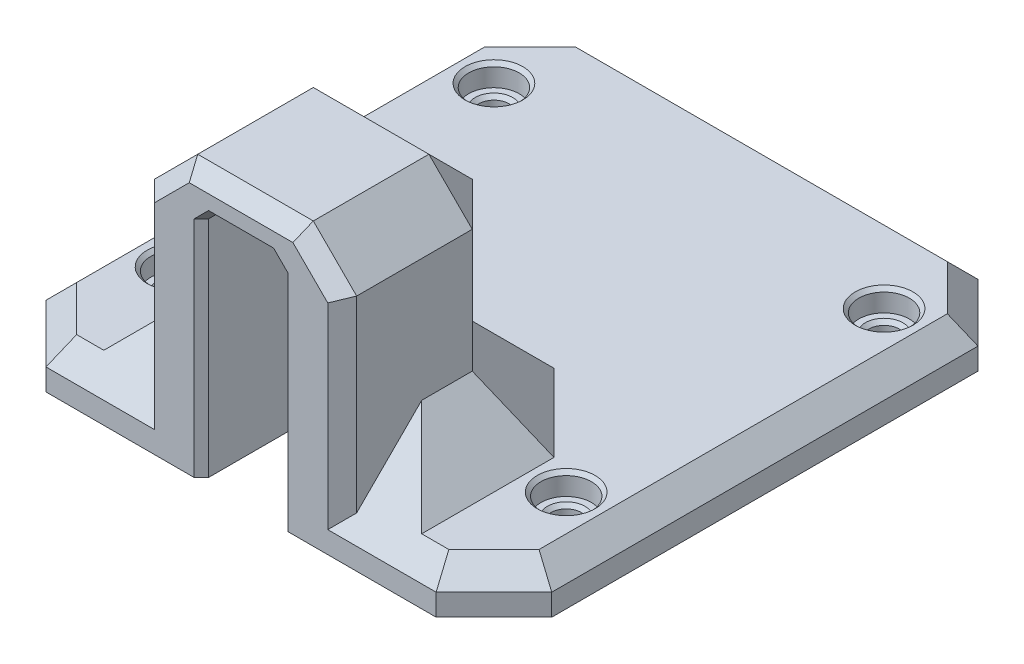
from build123d import *

# Parameters (mm, degrees)
SKETCH1_R                          = 2.1
MAIN_CAP_EXTRUDE_DEPTH             = 6
MAIN_BODY_CHAMFER_SIZE             = 3
SKETCH4_R                          = 3.5
HOLE_COUNTERSINK_CUT_DEPTH         = 3
HOLE_COUNTERSINK_CHAMFER_SIZE      = 0.5
MAIN_PINION_CHIMNEY_EXTRUDE_DEPTH  = 32
SKETCH3_W                          = 28
SKETCH3_H                          = 24
PINION_CHIMNEY_CAP_EXTRUDE_DEPTH   = 5
INTERNAL_CHIMNEY_CHAMFER_SIZE      = 1
MAIN_CHIMNEY_EXTERNAL_CHAMFER_SIZE = 6
CHIMNEY_PLATE_CHAMFER_SIZE         = 8
CHIMNEY_FRONT_CHAMFER_SIZE         = 2


with BuildPart() as part:
    # Sketch1 → Main Cap Extrude (new body)
    with BuildSketch(Plane(origin=(0, 0, 0), x_dir=(1, 0, 0), z_dir=(0, 1, 0))):
        Polygon((-35, 27), (-27, 35), (27, 35), (35, 27), (35, -32), (27, -40), (5.5, -40), (5.5, -27.857106781), (9.5, -23.857106781), (9.5, -20.65), (-9.5, -20.65), (-9.5, -23.857106781), (-5.5, -27.857106781), (-5.5, -40), (-27, -40), (-35, -32), align=None)
        with Locations(Location((-27, 22, 0), (0, 0, 270))):
            Circle(SKETCH1_R, mode=Mode.SUBTRACT)
        with Locations(Location((27, 22, 0), (0, 0, 90))):
            Circle(SKETCH1_R, mode=Mode.SUBTRACT)
        with Locations(Location((27, -22, 0), (0, 0, 270))):
            Circle(SKETCH1_R, mode=Mode.SUBTRACT)
        with Locations(Location((-27, -22, 0), (0, 0, 90))):
            Circle(SKETCH1_R, mode=Mode.SUBTRACT)
    extrude(amount=MAIN_CAP_EXTRUDE_DEPTH)

    # Main Body Chamfer
    main_body_chamfer_edges = [part.edges().sort_by_distance(p)[0] for p in [
        (-31, 6, -31),
        (-35, 6, 2.5),
        (-31, 6, 36),
        (-16.25, 6, 40),
        (31, 6, -31),
        (16.25, 6, 40),
        (31, 6, 36),
        (35, 6, 2.5),
        (0, 6, -35),
    ]]
    chamfer(main_body_chamfer_edges, length=MAIN_BODY_CHAMFER_SIZE)

    # Sketch4 → Hole Countersink Cut (cut)
    with BuildSketch(Plane(origin=(0, 6, 0), x_dir=(1, 0, 0), z_dir=(0, 1, 0))):
        with Locations(Location((-27, 22, 0), (0, 0, 270))):
            Circle(SKETCH4_R)
        with Locations(Location((-27, -22, 0), (0, 0, 270))):
            Circle(SKETCH4_R)
        with Locations(Location((27, -22, 0), (0, 0, 270))):
            Circle(SKETCH4_R)
        with Locations(Location((27, 22, 0), (0, 0, 270))):
            Circle(SKETCH4_R)
    extrude(amount=-HOLE_COUNTERSINK_CUT_DEPTH, mode=Mode.SUBTRACT)

    # Hole Countersink Chamfer
    hole_countersink_chamfer_edges = [part.edges().sort_by_distance(p)[0] for p in [
        (27, 3, -19.9),
        (27, 6, -25.5),
        (27, 3, 19.9),
        (27, 6, 18.5),
        (-27, 3, 24.1),
        (-27, 6, 18.5),
        (-27, 3, -24.1),
        (-27, 6, -25.5),
    ]]
    chamfer(hole_countersink_chamfer_edges, length=HOLE_COUNTERSINK_CHAMFER_SIZE)

    # Sketch2 → Main Pinion Chimney Extrude (add)
    with BuildSketch(Plane(origin=(0, 0, 0), x_dir=(1, 0, 0), z_dir=(0, 1, 0))):
        Polygon((5.5, -27.857106781), (5.5, -40), (14, -40), (14, -16), (-14, -16), (-14, -40), (-5.5, -40), (-5.5, -27.857106781), (-9.5, -23.857106781), (-9.5, -20.65), (9.5, -20.65), (9.5, -23.857106781), align=None)
    extrude(amount=MAIN_PINION_CHIMNEY_EXTRUDE_DEPTH)

    # Sketch3 → Pinion Chimney Cap Extrude (add)
    with BuildSketch(Plane(origin=(0, 32, 0), x_dir=(1, 0, 0), z_dir=(0, 1, 0))):
        with Locations((0, -28)):
            Rectangle(SKETCH3_W, SKETCH3_H)
    extrude(amount=PINION_CHIMNEY_CAP_EXTRUDE_DEPTH)

    # Internal Chimney Chamfer
    internal_chimney_chamfer_edges = [part.edges().sort_by_distance(p)[0] for p in [
        (9.5, 32, 22.253553391),
        (7.5, 32, 25.857106781),
        (5.5, 32, 33.928553391),
        (-5.5, 32, 33.928553391),
        (-7.5, 32, 25.857106781),
        (-9.5, 32, 22.253553391),
        (0, 32, 20.65),
        (0, 32, 40),
        (-5.5, 16, 40),
        (5.5, 16, 40),
    ]]
    chamfer(internal_chimney_chamfer_edges, length=INTERNAL_CHIMNEY_CHAMFER_SIZE)

    # Main Chimney External Chamfer
    main_chimney_external_chamfer_edges = [part.edges().sort_by_distance(p)[0] for p in [
        (14, 21.5, 16),
        (-14, 21.5, 16),
        (-14, 37, 28),
        (14, 37, 28),
        (0, 37, 16),
    ]]
    chamfer(main_chimney_external_chamfer_edges, length=MAIN_CHIMNEY_EXTERNAL_CHAMFER_SIZE)

    # Chimney Plate Chamfer
    chimney_plate_chamfer_edges = [part.edges().sort_by_distance(p)[0] for p in [
        (-14, 6, 29.5),
        (0, 6, 16),
        (14, 6, 29.5),
        (11, 6, 19),
        (-11, 6, 19),
    ]]
    chamfer(chimney_plate_chamfer_edges, length=CHIMNEY_PLATE_CHAMFER_SIZE)

    # Chimney Front Chamfer
    chimney_front_chamfer_edges = [part.edges().sort_by_distance(p)[0] for p in [
        (14, 17, 40),
        (-14, 17, 40),
        (0, 37, 40),
        (11, 34, 40),
        (-11, 34, 40),
    ]]
    chamfer(chimney_front_chamfer_edges, length=CHIMNEY_FRONT_CHAMFER_SIZE)


solid = part.part
